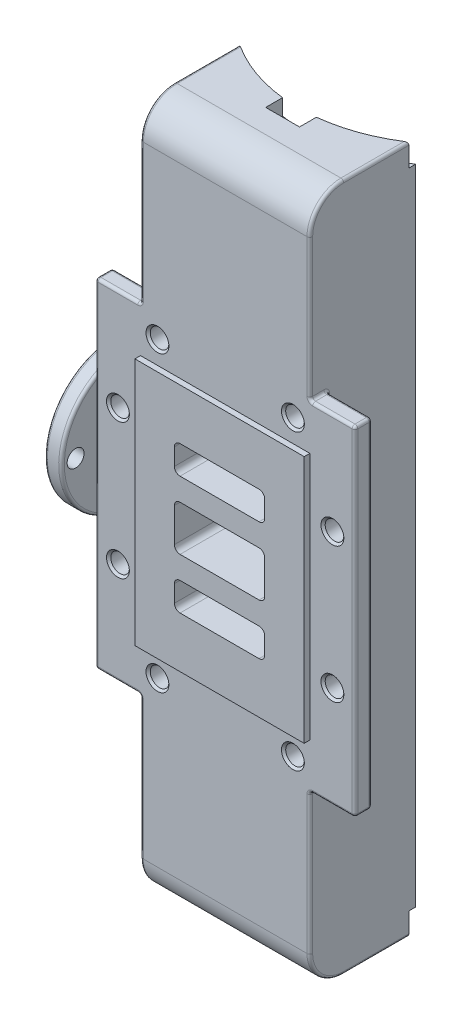
from build123d import *

# Parameters (mm, degrees)
SKETCH1_W                       = 30
SKETCH1_H                       = 44
BOSS_EXTRUDE1_DEPTH             = 18.8
BOSS_EXTRUDE2_START             = 1
SKETCH1_3_W                     = 30
SKETCH1_3_H                     = 44
BOSS_EXTRUDE2_DEPTH             = 1
BOSS_EXTRUDE5_DEPTH             = 3
M4X0_7_TAPPED_HOLE2_D           = 3.3
M4X0_7_TAPPED_HOLE2_CSINK_D     = 4.05
M4X0_7_TAPPED_HOLE2_CSINK_ANGLE = 90
FILLET2_R                       = 6
SKETCH7_R                       = 6
SKETCH7_R_2                     = 4.5
BOSS_EXTRUDE6_DEPTH             = 12
SKETCH8_R                       = 12.5
SKETCH8_R_2                     = 4.5
SKETCH8_R_3                     = 1.5
BOSS_EXTRUDE7_DEPTH             = 3
CUT_EXTRUDE1_DEPTH              = 128.72235513
CUT_EXTRUDE2_DEPTH              = 4
CUT_EXTRUDE3_DEPTH              = 48
CUT_EXTRUDE5_START              = -24
SKETCH11_R                      = 4.5
CUT_EXTRUDE5_DEPTH              = 24
FILLET3_R                       = 0.5


with BuildPart() as part:
    # Sketch1 → Boss-Extrude1 (new body)
    # profile 1 of 3: a face of its own
    with BuildSketch(Plane.XY):
        Polygon((15, 30), (15, 61), (-15, 61), (-15, 30), (-15, 22), (15, 22), align=None)
    # profile 2 of 3: a face of its own
    with BuildSketch(Plane.XY):
        Rectangle(SKETCH1_W, SKETCH1_H)
        with BuildLine():
            Line((-8, -12), (-8, -9))
            ThreePointArc((-8, -9), (-7.707106781, -8.292893219), (-7, -8))
            Line((-7, -8), (7, -8))
            ThreePointArc((7, -8), (7.707106781, -8.292893219), (8, -9))
            Line((8, -9), (8, -12))
            ThreePointArc((8, -12), (7.707106781, -12.707106781), (7, -13))
            Line((7, -13), (-7, -13))
            ThreePointArc((-7, -13), (-7.707106781, -12.707106781), (-8, -12))
        make_face(mode=Mode.SUBTRACT)
        with BuildLine():
            Line((-8, -3), (-8, 3))
            ThreePointArc((-8, 3), (-7.707106781, 3.707106781), (-7, 4))
            Line((-7, 4), (7, 4))
            ThreePointArc((7, 4), (7.707106781, 3.707106781), (8, 3))
            Line((8, 3), (8, -3))
            ThreePointArc((8, -3), (7.707106781, -3.707106781), (7, -4))
            Line((7, -4), (-7, -4))
            ThreePointArc((-7, -4), (-7.707106781, -3.707106781), (-8, -3))
        make_face(mode=Mode.SUBTRACT)
        with BuildLine():
            Line((-8, 9), (-8, 12))
            ThreePointArc((-8, 12), (-7.707106781, 12.707106781), (-7, 13))
            Line((-7, 13), (7, 13))
            ThreePointArc((7, 13), (7.707106781, 12.707106781), (8, 12))
            Line((8, 12), (8, 9))
            ThreePointArc((8, 9), (7.707106781, 8.292893219), (7, 8))
            Line((7, 8), (-7, 8))
            ThreePointArc((-7, 8), (-7.707106781, 8.292893219), (-8, 9))
        make_face(mode=Mode.SUBTRACT)
    # profile 3 of 3: a face of its own
    with BuildSketch(Plane.XY):
        Polygon((15, -30), (15, -22), (-15, -22), (-15, -30), (-15, -61), (15, -61), align=None)
    extrude(amount=-BOSS_EXTRUDE1_DEPTH)

    # Sketch1<3> → Boss-Extrude2 (add)
    with BuildSketch(Plane.XY.offset(BOSS_EXTRUDE2_START)):
        Rectangle(SKETCH1_3_W, SKETCH1_3_H)
        with BuildLine():
            Line((-8, -12), (-8, -9))
            ThreePointArc((-8, -9), (-7.707106781, -8.292893219), (-7, -8))
            Line((-7, -8), (7, -8))
            ThreePointArc((7, -8), (7.707106781, -8.292893219), (8, -9))
            Line((8, -9), (8, -12))
            ThreePointArc((8, -12), (7.707106781, -12.707106781), (7, -13))
            Line((7, -13), (-7, -13))
            ThreePointArc((-7, -13), (-7.707106781, -12.707106781), (-8, -12))
        make_face(mode=Mode.SUBTRACT)
        with BuildLine():
            Line((-8, -3), (-8, 3))
            ThreePointArc((-8, 3), (-7.707106781, 3.707106781), (-7, 4))
            Line((-7, 4), (7, 4))
            ThreePointArc((7, 4), (7.707106781, 3.707106781), (8, 3))
            Line((8, 3), (8, -3))
            ThreePointArc((8, -3), (7.707106781, -3.707106781), (7, -4))
            Line((7, -4), (-7, -4))
            ThreePointArc((-7, -4), (-7.707106781, -3.707106781), (-8, -3))
        make_face(mode=Mode.SUBTRACT)
        with BuildLine():
            Line((-8, 9), (-8, 12))
            ThreePointArc((-8, 12), (-7.707106781, 12.707106781), (-7, 13))
            Line((-7, 13), (7, 13))
            ThreePointArc((7, 13), (7.707106781, 12.707106781), (8, 12))
            Line((8, 12), (8, 9))
            ThreePointArc((8, 9), (7.707106781, 8.292893219), (7, 8))
            Line((7, 8), (-7, 8))
            ThreePointArc((-7, 8), (-7.707106781, 8.292893219), (-8, 9))
        make_face(mode=Mode.SUBTRACT)
    extrude(amount=-BOSS_EXTRUDE2_DEPTH)

    # Sketch1<6> → Boss-Extrude5 (add)
    with BuildSketch(Plane.XY):
        Polygon((23, 30), (15, 30), (15, 22), (15, -22), (15, -30), (23, -30), align=None)
        Polygon((-15, 22), (-15, 30), (-23, 30), (-23, -30), (-15, -30), (-15, -22), align=None)
    extrude(amount=-BOSS_EXTRUDE5_DEPTH)

    # M4x0.7 Tapped Hole2 (through all)
    with Locations(Plane.XY):
        with Locations((12, 26), (19, 12), (19, -12), (12, -26)):
            m4x0_7_tapped_hole2 = CounterSinkHole(M4X0_7_TAPPED_HOLE2_D / 2, M4X0_7_TAPPED_HOLE2_CSINK_D / 2, counter_sink_angle=M4X0_7_TAPPED_HOLE2_CSINK_ANGLE)

    # Mirror2: M4x0.7 Tapped Hole2 across plane
    add(m4x0_7_tapped_hole2.mirror(Plane(origin=(0, 0, 0), x_dir=(0, 0, 1), z_dir=(1, 0, 0))), mode=Mode.SUBTRACT)

    # Fillet2
    fillet2_edges = [part.edges().sort_by_distance(p)[0] for p in [
        (0, -61, 0),
        (0, 61, 0),
    ]]
    fillet(fillet2_edges, radius=FILLET2_R)

    # Sketch7 → Boss-Extrude6 (add)
    with BuildSketch(Plane.ZY.offset(15)):
        with Locations(Location((-10.5, 0, 0), (0, 0, 270))):
            Circle(SKETCH7_R)
        with Locations(Location((-10.5, 0, 0), (0, 0, 270))):
            Circle(SKETCH7_R_2, mode=Mode.SUBTRACT)
    extrude(amount=BOSS_EXTRUDE6_DEPTH)

    # Sketch8 → Boss-Extrude7 (add)
    with BuildSketch(Plane.ZY.offset(27)):
        with Locations(Location((-10.5, 0, 0), (0, 0, 270))):
            Circle(SKETCH8_R)
        with Locations(Location((-10.5, 0, 0), (0, 0, 270))):
            Circle(SKETCH8_R_2, mode=Mode.SUBTRACT)
        with Locations(Location((-10.5, 10, 0), (0, 0, 270))):
            Circle(SKETCH8_R_3, mode=Mode.SUBTRACT)
        with Locations(Location((-0.5, 0, 0), (0, 0, 270))):
            Circle(SKETCH8_R_3, mode=Mode.SUBTRACT)
        with Locations(Location((-10.5, -10, 0), (0, 0, 270))):
            Circle(SKETCH8_R_3, mode=Mode.SUBTRACT)
        with Locations(Location((-20.5, 0, 0), (0, 0, 270))):
            Circle(SKETCH8_R_3, mode=Mode.SUBTRACT)
    extrude(amount=BOSS_EXTRUDE7_DEPTH)

    # Sketch9 → Cut-Extrude1 (cut, through all)
    with BuildSketch(Plane.XZ.offset(61)):
        with BuildLine():
            ThreePointArc((15, -18.763239418), (9.287952789, -15.715561917), (3, -14.17365686))
            ThreePointArc((3, -14.17365686), (0, -14), (-3, -14.17365686))
            ThreePointArc((-3, -14.17365686), (-9.287952789, -15.715561917), (-15, -18.763239418))
            Line((-15, -18.763239418), (-15, -18.8))
            Line((-15, -18.8), (15, -18.8))
            Line((15, -18.8), (15, -18.763239418))
        make_face()
    extrude(amount=-CUT_EXTRUDE1_DEPTH, mode=Mode.SUBTRACT)

    # Sketch9<4> → Cut-Extrude2 (cut)
    with BuildSketch(Plane.XZ.offset(61)):
        with BuildLine():
            ThreePointArc((-15, -18.763239418), (-9.287952789, -15.715561917), (-3, -14.17365686))
            Line((-3, -14.17365686), (-3, -13.16718427))
            ThreePointArc((-3, -13.16718427), (-9.262957975, -14.638659153), (-15, -17.550055679))
            Line((-15, -17.550055679), (-15, -18.763239418))
        make_face()
        with BuildLine():
            Line((3, -13.16718427), (3, -14.17365686))
            ThreePointArc((3, -14.17365686), (9.287952789, -15.715561917), (15, -18.763239418))
            Line((15, -18.763239418), (15, -17.550055679))
            ThreePointArc((15, -17.550055679), (9.262957975, -14.638659153), (3, -13.16718427))
        make_face()
    cut_extrude2 = extrude(amount=-CUT_EXTRUDE2_DEPTH, mode=Mode.SUBTRACT)

    # Sketch9<6> → Cut-Extrude3 (cut)
    with BuildSketch(Plane.XZ.offset(61)):
        with BuildLine():
            ThreePointArc((-3, -14.17365686), (0, -14), (3, -14.17365686))
            Line((3, -14.17365686), (3, -13.16718427))
            Line((3, -13.16718427), (3, -10.17365686))
            Line((3, -10.17365686), (-3, -10.17365686))
            Line((-3, -10.17365686), (-3, -13.16718427))
            Line((-3, -13.16718427), (-3, -14.17365686))
        make_face()
    cut_extrude3 = extrude(amount=-CUT_EXTRUDE3_DEPTH, mode=Mode.SUBTRACT)

    # Mirror3: Cut-Extrude2, Cut-Extrude3 across plane
    add(cut_extrude2.mirror(Plane.ZX), mode=Mode.SUBTRACT)
    add(cut_extrude3.mirror(Plane.ZX), mode=Mode.SUBTRACT)

    # Sketch11 → Cut-Extrude5 (cut)
    with BuildSketch(Plane.ZY.offset(30).offset(CUT_EXTRUDE5_START)):
        with Locations(Location((-10.5, 0, 0), (0, 0, 117.266044451))):
            Circle(SKETCH11_R)
    extrude(amount=CUT_EXTRUDE5_DEPTH, mode=Mode.SUBTRACT)

    # Fillet3
    fillet3_edges = [part.edges().sort_by_distance(p)[0] for p in [
        (15, -42.5, 0),
        (19, 30, -3),
        (15, 30, -1.5),
        (23, 0, -3),
        (23, 30, -1.5),
        (19, -30, -3),
        (23, -30, -1.5),
        (15, 0, -3),
        (15, -30, -1.5),
        (19, 30, 0),
        (19, -30, 0),
        (23, 0, 0),
        (-15, -42.5, 0),
        (-15, 30, -1.5),
        (-19, -30, -3),
        (-15, -30, -1.5),
        (-23, 0, -3),
        (-23, -30, -1.5),
        (-19, 30, -3),
        (-23, 30, -1.5),
        (-15, 0, -3),
        (-19, 30, 0),
        (-23, 0, 0),
        (-19, -30, 0),
        (-15, 42.5, 0),
        (15, 42.5, 0),
        (15, 59.242640687, -1.757359313),
        (15, -59.242640687, -1.757359313),
        (-15, 59.242640687, -1.757359313),
        (-15, -59.242640687, -1.757359313),
        (-30, 12.5, -10.5),
        (-27, 12.5, -10.5),
        (-15, -61, -11.77502784),
        (15, -61, -11.77502784),
        (15, 61, -11.77502784),
        (-15, 61, -11.77502784),
    ]]
    fillet(fillet3_edges, radius=FILLET3_R)


solid = part.part
